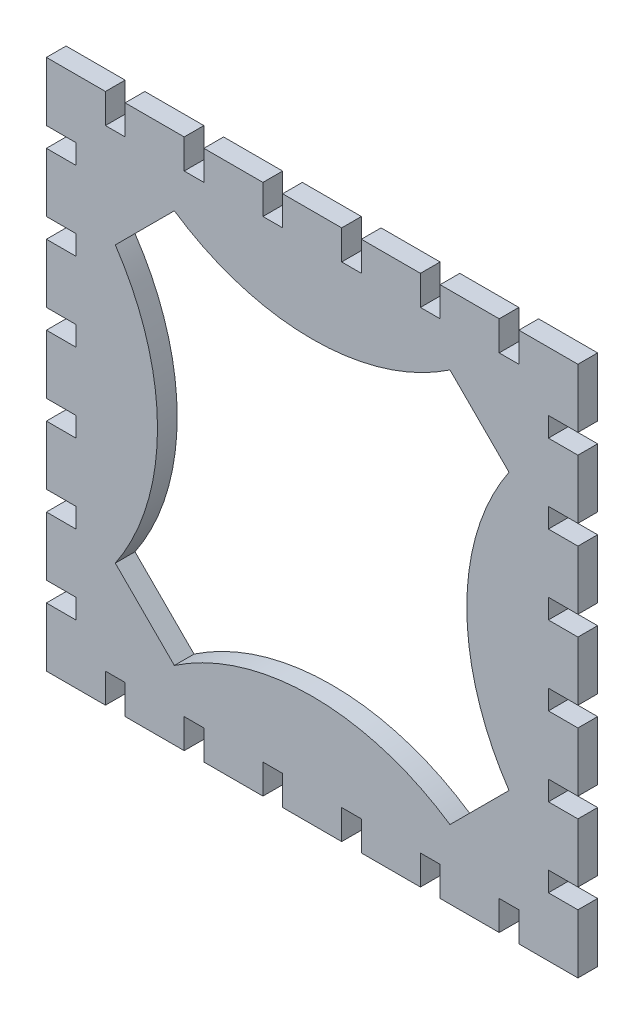
from build123d import *

# Parameters (mm, degrees)
BOSS_EXTRUDE1_DEPTH = 3


with BuildPart() as part:
    # Sketch1 → Boss-Extrude1 (new body)
    with BuildSketch(Plane.XY):
        Polygon((237, 253.5), (241.5, 253.5), (241.5, 262.5), (237, 262.5), (237, 265.5), (241.5, 265.5), (241.5, 274.5), (232.5, 274.5), (232.5, 270), (229.5, 270), (229.5, 274.5), (220.5, 274.5), (220.5, 270), (217.5, 270), (217.5, 274.5), (208.5, 274.5), (208.5, 270), (205.5, 270), (205.5, 274.5), (196.5, 274.5), (196.5, 270), (193.5, 270), (193.5, 274.5), (184.5, 274.5), (184.5, 270), (181.5, 270), (181.5, 274.5), (172.5, 274.5), (172.5, 270), (169.5, 270), (169.5, 274.5), (160.5, 274.5), (160.5, 265.5), (165, 265.5), (165, 262.5), (160.5, 262.5), (160.5, 253.5), (165, 253.5), (165, 250.5), (160.5, 250.5), (160.5, 241.5), (165, 241.5), (165, 238.5), (160.5, 238.5), (160.5, 229.5), (165, 229.5), (165, 226.5), (160.5, 226.5), (160.5, 217.5), (165, 217.5), (165, 214.5), (160.5, 214.5), (160.5, 205.5), (165, 205.5), (165, 202.5), (160.5, 202.5), (160.5, 193.5), (169.5, 193.5), (169.5, 198), (172.5, 198), (172.5, 193.5), (181.5, 193.5), (181.5, 198), (184.5, 198), (184.5, 193.5), (193.5, 193.5), (193.5, 198), (196.5, 198), (196.5, 193.5), (205.5, 193.5), (205.5, 198), (208.5, 198), (208.5, 193.5), (217.5, 193.5), (217.5, 198), (220.5, 198), (220.5, 193.5), (229.5, 193.5), (229.5, 198), (232.5, 198), (232.5, 193.5), (241.5, 193.5), (241.5, 202.5), (237, 202.5), (237, 205.5), (241.5, 205.5), (241.5, 214.5), (237, 214.5), (237, 217.5), (241.5, 217.5), (241.5, 226.5), (237, 226.5), (237, 229.5), (241.5, 229.5), (241.5, 238.5), (237, 238.5), (237, 241.5), (241.5, 241.5), (241.5, 250.5), (237, 250.5), align=None)
        with BuildLine():
            Line((180, 204), (171, 213))
            ThreePointArc((171, 213), (177.431527234, 234), (171, 255))
            Line((171, 255), (180, 264))
            ThreePointArc((180, 264), (201, 257.568472766), (222, 264))
            Line((222, 264), (231, 255))
            ThreePointArc((231, 255), (224.568472766, 234), (231, 213))
            Line((231, 213), (222, 204))
            ThreePointArc((222, 204), (201, 210.431527234), (180, 204))
        make_face(mode=Mode.SUBTRACT)
    extrude(amount=BOSS_EXTRUDE1_DEPTH)


solid = part.part
